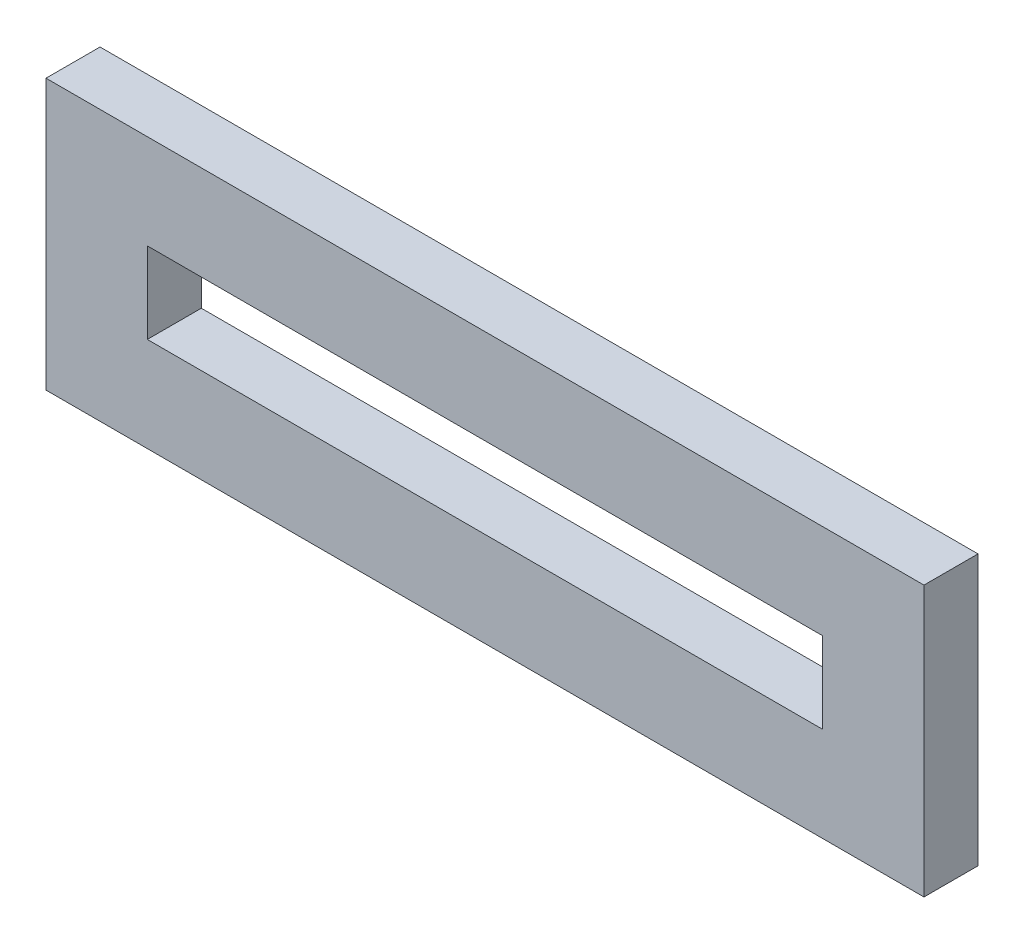
from build123d import *

# Parameters (mm, degrees)
SKETCH2_W           = 65
SKETCH2_H           = 20
BOSS_EXTRUDE1_DEPTH = 4
SKETCH3_W           = 50
SKETCH3_H           = 6
CUT_EXTRUDE1_DEPTH  = 10


with BuildPart() as part:
    # Sketch2 → Boss-Extrude1 (new body)
    with BuildSketch(Plane.XY):
        Rectangle(SKETCH2_W, SKETCH2_H)
    extrude(amount=BOSS_EXTRUDE1_DEPTH)

    # Sketch3 → Cut-Extrude1 (cut)
    with BuildSketch(Plane.XY):
        Rectangle(SKETCH3_W, SKETCH3_H)
    extrude(amount=CUT_EXTRUDE1_DEPTH, mode=Mode.SUBTRACT)


solid = part.part
